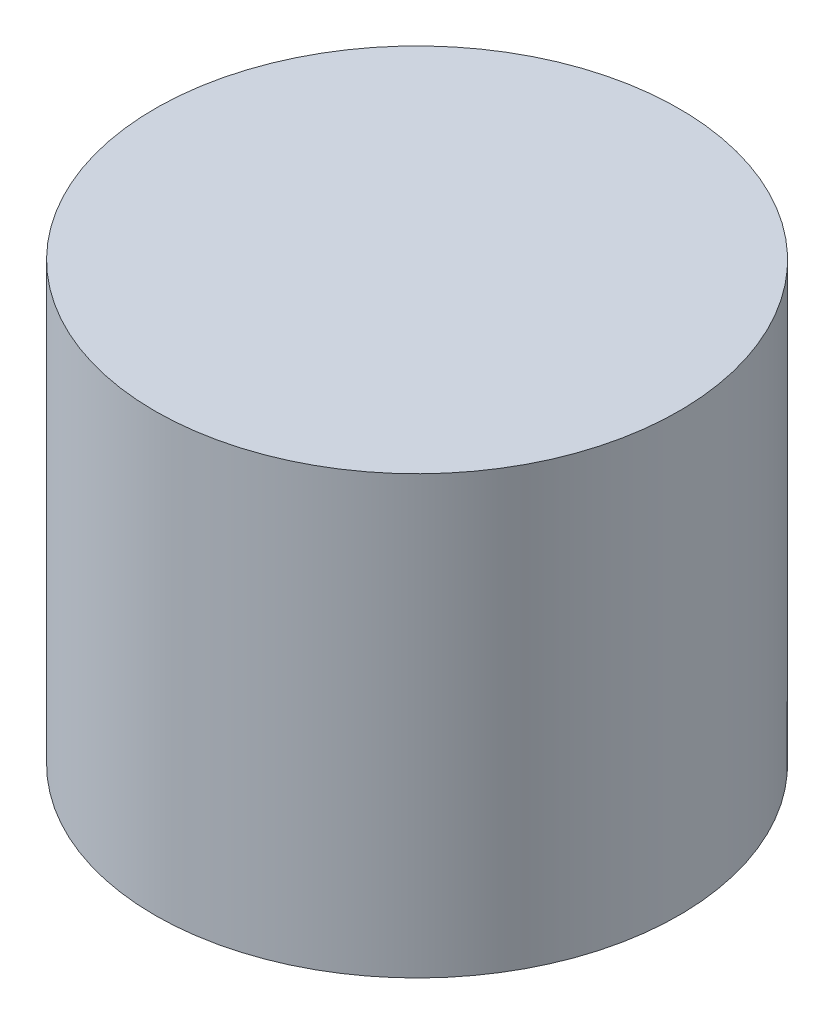
from build123d import *

# Parameters (mm, degrees)
SKETCH_1_R      = 15
EXTRUDE_1_DEPTH = 25


with BuildPart() as part:
    # 草图1 → 凸台-拉伸1 (new body)
    with BuildSketch(Plane(origin=(0, 0, 0), x_dir=(1, 0, 0), z_dir=(0, 1, 0))):
        with Locations(Location((12.5, -12.5, 0), (0, 0, 270))):
            Circle(SKETCH_1_R)
    extrude(amount=EXTRUDE_1_DEPTH)


solid = part.part
